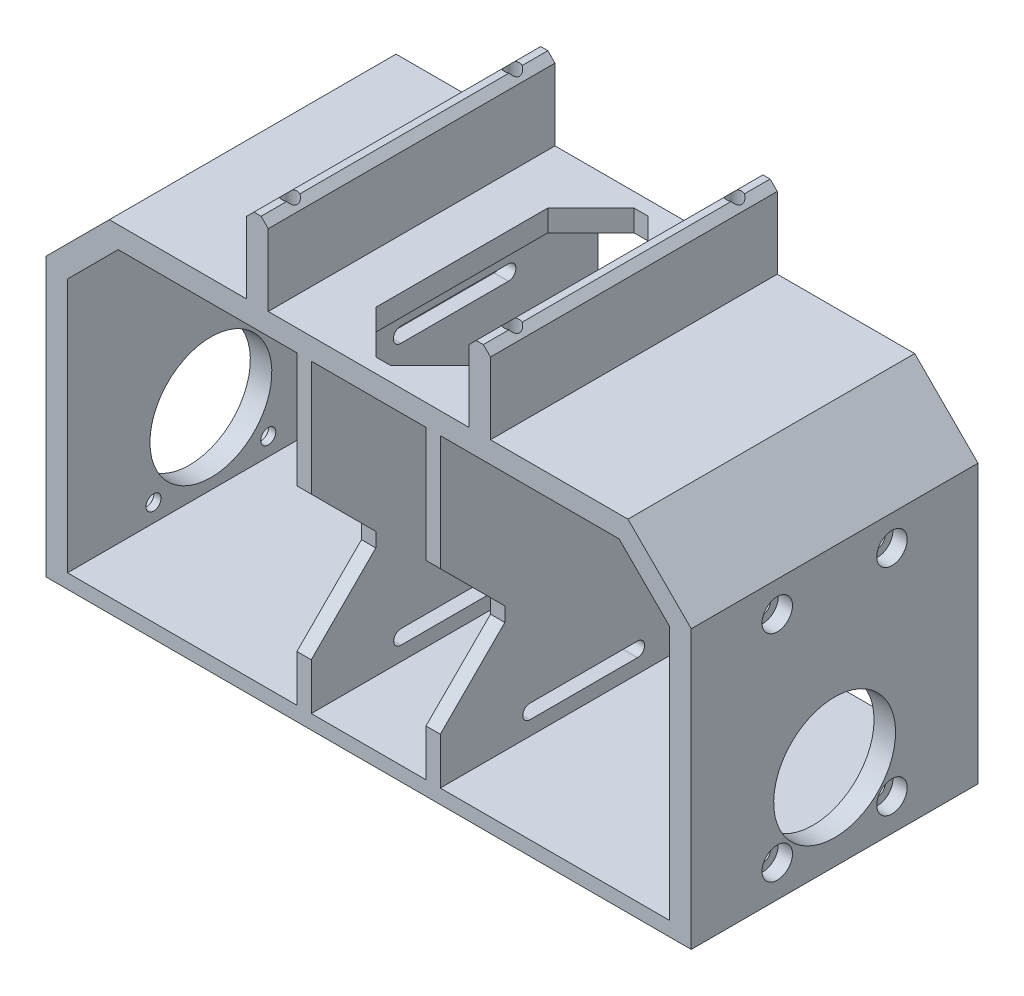
from build123d import *

# Parameters (mm, degrees)
BOSS_EXTRUDE3_DEPTH      = 20
BOSS_EXTRUDE3_DEPTH_BACK = 20
SKETCH4_R                = 8.5
CUT_EXTRUDE1_DEPTH       = 103.622615216
SKETCH5_R                = 1.05
CUT_EXTRUDE2_DEPTH       = 103.622615216
BOSS_EXTRUDE4_START      = -20
SKETCH6_W                = 2
SKETCH6_H                = 42.571067812
BOSS_EXTRUDE4_DEPTH      = 40
CUT_EXTRUDE4_REACH       = 75.867
SKETCH8_R                = 2.125
CUT_EXTRUDE5_DEPTH       = 2
BOSS_EXTRUDE5_DEPTH      = 40
SKETCH10_R               = 1.05
CUT_EXTRUDE6_DEPTH       = 10
CUT_EXTRUDE7_REACH       = 83.049
CUT_EXTRUDE8_DEPTH       = 3


with BuildPart() as part:
    # Sketch3 → Boss-Extrude3 (new, two sides: drawn at the far end of the back side and taken through both)
    with BuildSketch(Plane.XY.offset(-BOSS_EXTRUDE3_DEPTH_BACK)):
        Polygon((-45, 0), (-45, 36.242640687), (-36.171572875, 45.071067812), (36.171572875, 45.071067812), (45, 36.242640687), (45, 0), (45, -2.5), (-45, -2.5), align=None)
        Polygon((-42, 0), (-42, 35), (-34.928932188, 42.071067812), (34.928932188, 42.071067812), (42, 35), (42, 0), (42, -0.5), (-42, -0.5), align=None, mode=Mode.SUBTRACT)
    extrude(amount=BOSS_EXTRUDE3_DEPTH + BOSS_EXTRUDE3_DEPTH_BACK)

    # Sketch4 → Cut-Extrude1 (cut, through all)
    with BuildSketch(Plane.ZY.offset(45)):
        with Locations(Location((0, 9.5, 0), (0, 0, 270))):
            Circle(SKETCH4_R)
    extrude(amount=-CUT_EXTRUDE1_DEPTH, mode=Mode.SUBTRACT)

    # Sketch5 → Cut-Extrude2 (cut, through all)
    with BuildSketch(Plane.ZY.offset(45)):
        with Locations(Location((-8, 32, 0), (0, 0, 270))):
            Circle(SKETCH5_R)
        with Locations(Location((8, 32, 0), (0, 0, 270))):
            Circle(SKETCH5_R)
        with Locations(Location((8, 2, 0), (0, 0, 270))):
            Circle(SKETCH5_R)
        with Locations(Location((-8, 2, 0), (0, 0, 270))):
            Circle(SKETCH5_R)
    extrude(amount=-CUT_EXTRUDE2_DEPTH, mode=Mode.SUBTRACT)

    # Sketch6 → Boss-Extrude4 (add)
    with BuildSketch(Plane.XY.offset(BOSS_EXTRUDE4_START)):
        with Locations((-9, 20.785533906)):
            Rectangle(SKETCH6_W, SKETCH6_H)
        with Locations((9, 20.785533906)):
            Rectangle(SKETCH6_W, SKETCH6_H)
    extrude(amount=BOSS_EXTRUDE4_DEPTH)

    # Cut-Extrude4: up to this face of the body (flat: up to its plane)
    cut_extrude4_end = Plane(part.part.faces().sort_by_distance((10, 20.785533906, 0))[0])
    # Sketch7 → Cut-Extrude4 (cut, up to the picked face)
    with BuildSketch(Plane.ZY.offset(10), mode=Mode.PRIVATE) as cut_extrude4_sk1:
        Polygon((-20, 26), (-20, 6), (-11, 15), (-11, 17), align=None)
    cut_extrude4_tool1 = split(extrude(cut_extrude4_sk1.sketch, amount=-CUT_EXTRUDE4_REACH, mode=Mode.PRIVATE), bisect_by=cut_extrude4_end, keep=Keep.BOTH, mode=Mode.PRIVATE)
    cut_extrude4 = cut_extrude4_tool1.solids().sort_by(Axis((-10, 16, -16.727273), (1, 0, 0)))[0]
    add(cut_extrude4, mode=Mode.SUBTRACT)

    # Mirror1: Cut-Extrude4 across plane
    add(cut_extrude4.mirror(Plane.XY), mode=Mode.SUBTRACT)

    # Sketch8 → Cut-Extrude5 (cut)
    with BuildSketch(Plane.ZY.offset(45)):
        with Locations(Location((-8, 32, 0), (0, 0, 270))):
            Circle(SKETCH8_R)
        with Locations(Location((8, 32, 0), (0, 0, 270))):
            Circle(SKETCH8_R)
        with Locations(Location((8, 2, 0), (0, 0, 270))):
            Circle(SKETCH8_R)
        with Locations(Location((-8, 2, 0), (0, 0, 270))):
            Circle(SKETCH8_R)
    cut_extrude5 = extrude(amount=-CUT_EXTRUDE5_DEPTH, mode=Mode.SUBTRACT)

    # Mirror2: Cut-Extrude5 across plane
    add(cut_extrude5.mirror(Plane(origin=(0, 0, 0), x_dir=(0, 0, 1), z_dir=(1, 0, 0))), mode=Mode.SUBTRACT)

    # Sketch9 → Boss-Extrude5 (add)
    with BuildSketch(Plane.XY.offset(20)):
        Polygon((17, 55.071067812), (16, 56.071067812), (15, 56.071067812), (14, 55.071067812), (14, 45.071067812), (17, 45.071067812), align=None)
    boss_extrude5 = extrude(amount=-BOSS_EXTRUDE5_DEPTH)

    # Mirror3: Boss-Extrude5 across plane
    add(boss_extrude5.mirror(Plane(origin=(0, 0, 0), x_dir=(0, 0, 1), z_dir=(1, 0, 0))))

    # Sketch10 → Cut-Extrude6 (cut)
    with BuildSketch(Plane(origin=(0, 56.071067812, 0), x_dir=(1, 0, 0), z_dir=(0, 1, 0))):
        with Locations(Location((-15.5, 15.5, 0), (0, 0, 180))):
            Circle(SKETCH10_R)
        with Locations(Location((15.5, 15.5, 0), (0, 0, 180))):
            Circle(SKETCH10_R)
        with Locations(Location((15.5, -15.5, 0), (0, 0, 180))):
            Circle(SKETCH10_R)
        with Locations(Location((-15.5, -15.5, 0), (0, 0, 180))):
            Circle(SKETCH10_R)
    extrude(amount=-CUT_EXTRUDE6_DEPTH, mode=Mode.SUBTRACT)

    # Cut-Extrude7: up to this face of the body (flat: up to its plane)
    cut_extrude7_end = Plane(part.part.faces().sort_by_distance((10, 21.415191548, 0))[0])
    # Sketch11 → Cut-Extrude7 (cut, up to the picked face)
    with BuildSketch(Plane.ZY.offset(10), mode=Mode.PRIVATE) as cut_extrude7_sk1:
        with BuildLine():
            Line((-7.5, 40.071067812), (7.5, 40.071067812))
            ThreePointArc((7.5, 40.071067812), (8.55, 39.021067812), (7.5, 37.971067812))
            Line((7.5, 37.971067812), (-7.5, 37.971067812))
            ThreePointArc((-7.5, 37.971067812), (-8.55, 39.021067812), (-7.5, 40.071067812))
        make_face()
    cut_extrude7_tool1 = split(extrude(cut_extrude7_sk1.sketch, amount=-CUT_EXTRUDE7_REACH, mode=Mode.PRIVATE), bisect_by=cut_extrude7_end, keep=Keep.BOTH, mode=Mode.PRIVATE)
    # Sketch11 → Cut-Extrude7 (cut, up to the picked face)
    with BuildSketch(Plane.ZY.offset(10), mode=Mode.PRIVATE) as cut_extrude7_sk2:
        with BuildLine():
            Line((-7.5, 3.5), (7.5, 3.5))
            ThreePointArc((7.5, 3.5), (8.5, 2.5), (7.5, 1.5))
            Line((7.5, 1.5), (-7.5, 1.5))
            ThreePointArc((-7.5, 1.5), (-8.5, 2.5), (-7.5, 3.5))
        make_face()
    cut_extrude7_tool2 = split(extrude(cut_extrude7_sk2.sketch, amount=-CUT_EXTRUDE7_REACH, mode=Mode.PRIVATE), bisect_by=cut_extrude7_end, keep=Keep.BOTH, mode=Mode.PRIVATE)
    add(cut_extrude7_tool1.solids().sort_by(Axis((-10, 39.021068, 0), (1, 0, 0)))[0], mode=Mode.SUBTRACT)
    add(cut_extrude7_tool2.solids().sort_by(Axis((-10, 2.5, 0), (1, 0, 0)))[0], mode=Mode.SUBTRACT)

    # Sketch12 → Cut-Extrude8 (cut)
    with BuildSketch(Plane(origin=(0, 45.071067812, 0), x_dir=(1, 0, 0), z_dir=(0, 1, 0))):
        Polygon((-7, 12), (-7, -12), (-1, -18), (1, -18), (7, -12), (7, 12), (1, 18), (-1, 18), align=None)
    extrude(amount=-CUT_EXTRUDE8_DEPTH, mode=Mode.SUBTRACT)


solid = part.part
